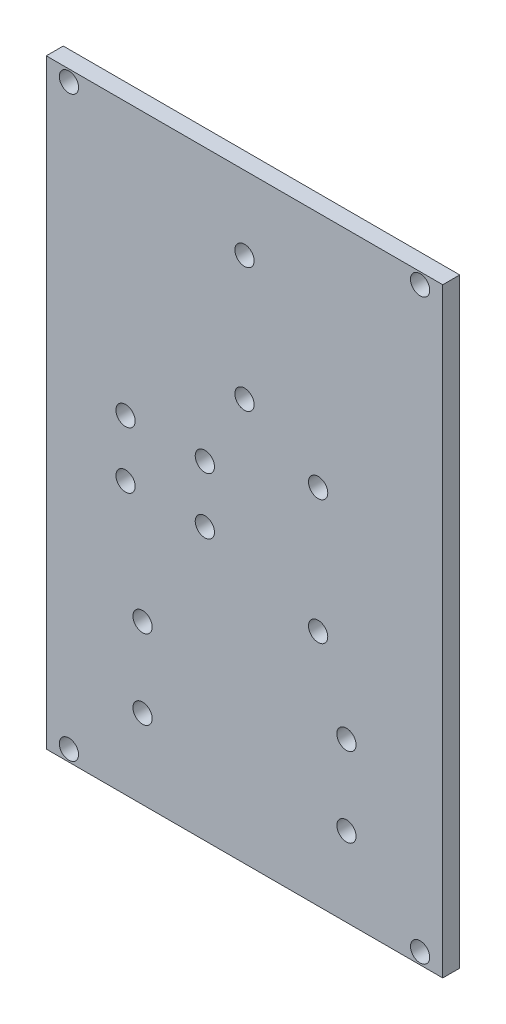
from build123d import *

# Parameters (mm, degrees)
MAIN_PROFILE_SKETCH_W = 70
MAIN_PROFILE_SKETCH_H = 106
MAIN_PROFILE_SKETCH_R = 1.7
MAIN_EXTRUSION_DEPTH  = 3


with BuildPart() as part:
    # Main Profile Sketch → Main Extrusion (new body)
    with BuildSketch(Plane.XY.offset(88)):
        with Locations((-203, 0)):
            Rectangle(MAIN_PROFILE_SKETCH_W, MAIN_PROFILE_SKETCH_H)
        with Locations((-234, -51)):
            Circle(MAIN_PROFILE_SKETCH_R, mode=Mode.SUBTRACT)
        with Locations((-221, -39)):
            Circle(MAIN_PROFILE_SKETCH_R, mode=Mode.SUBTRACT)
        with Locations((-221, -25)):
            Circle(MAIN_PROFILE_SKETCH_R, mode=Mode.SUBTRACT)
        with Locations((-224, -5)):
            Circle(MAIN_PROFILE_SKETCH_R, mode=Mode.SUBTRACT)
        with Locations((-210, -5)):
            Circle(MAIN_PROFILE_SKETCH_R, mode=Mode.SUBTRACT)
        with Locations((-172, -51)):
            Circle(MAIN_PROFILE_SKETCH_R, mode=Mode.SUBTRACT)
        with Locations((-185, -39)):
            Circle(MAIN_PROFILE_SKETCH_R, mode=Mode.SUBTRACT)
        with Locations((-190, -11)):
            Circle(MAIN_PROFILE_SKETCH_R, mode=Mode.SUBTRACT)
        with Locations((-185, -25)):
            Circle(MAIN_PROFILE_SKETCH_R, mode=Mode.SUBTRACT)
        with Locations((-224, 5)):
            Circle(MAIN_PROFILE_SKETCH_R, mode=Mode.SUBTRACT)
        with Locations((-210, 5)):
            Circle(MAIN_PROFILE_SKETCH_R, mode=Mode.SUBTRACT)
        with Locations((-234, 51)):
            Circle(MAIN_PROFILE_SKETCH_R, mode=Mode.SUBTRACT)
        with Locations((-190, 11)):
            Circle(MAIN_PROFILE_SKETCH_R, mode=Mode.SUBTRACT)
        with Locations((-203, 18)):
            Circle(MAIN_PROFILE_SKETCH_R, mode=Mode.SUBTRACT)
        with Locations((-203, 40)):
            Circle(MAIN_PROFILE_SKETCH_R, mode=Mode.SUBTRACT)
        with Locations((-172, 51)):
            Circle(MAIN_PROFILE_SKETCH_R, mode=Mode.SUBTRACT)
    extrude(amount=-MAIN_EXTRUSION_DEPTH)


solid = part.part
